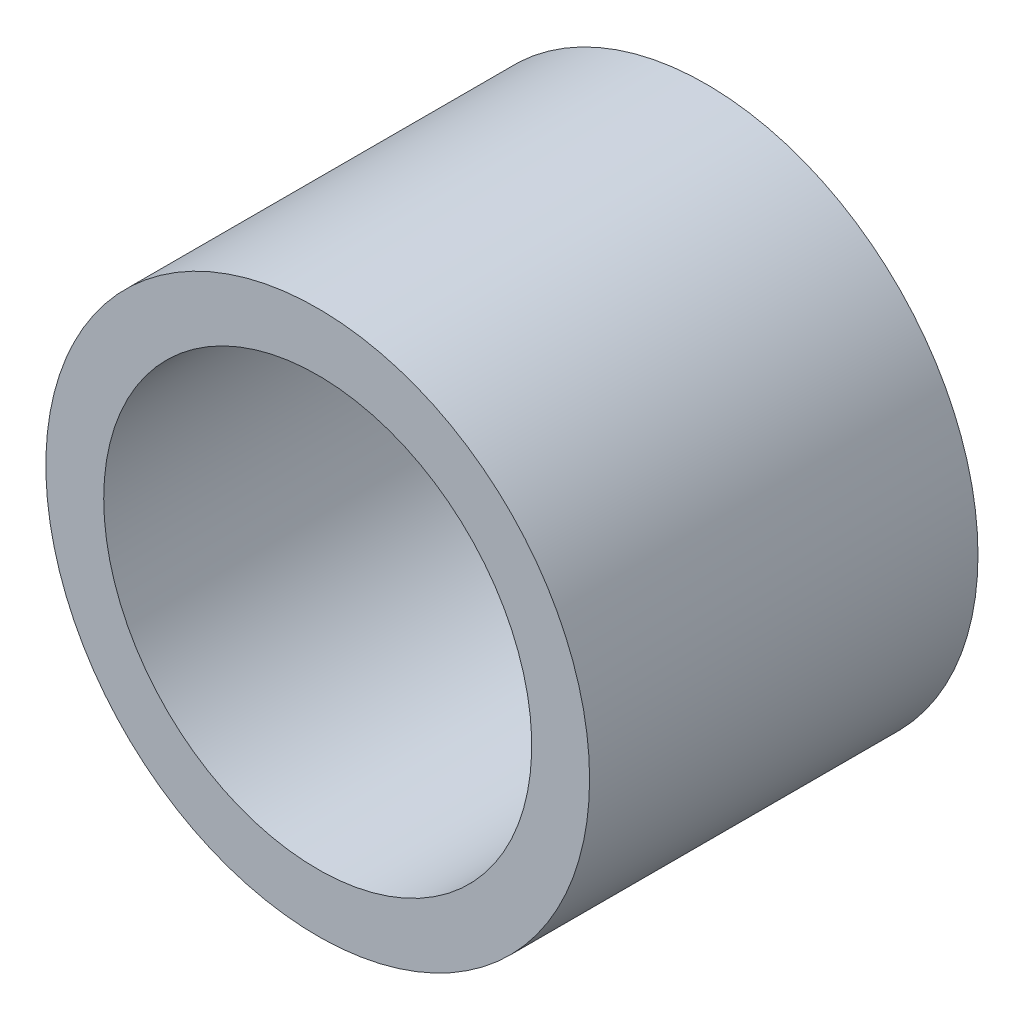
from build123d import *

# Parameters (mm, degrees)
SKETCH_1_R          = 14
EXTRUDE_2_DEPTH     = 20
SKETCH_4_R          = 11.02
CUT_EXTRUDE_2_DEPTH = 29.142494559


with BuildPart() as part:
    # 草图1 → 凸台-拉伸2 (new body)
    with BuildSketch(Plane.XY):
        Circle(SKETCH_1_R)
    extrude(amount=EXTRUDE_2_DEPTH)

    # 草图4 → 切除-拉伸2 (cut, through all)
    with BuildSketch(Plane(origin=(0, 0, 0), x_dir=(-1, 0, 0), z_dir=(0, 0, -1))):
        Circle(SKETCH_4_R)
    extrude(amount=-CUT_EXTRUDE_2_DEPTH, mode=Mode.SUBTRACT)


solid = part.part
